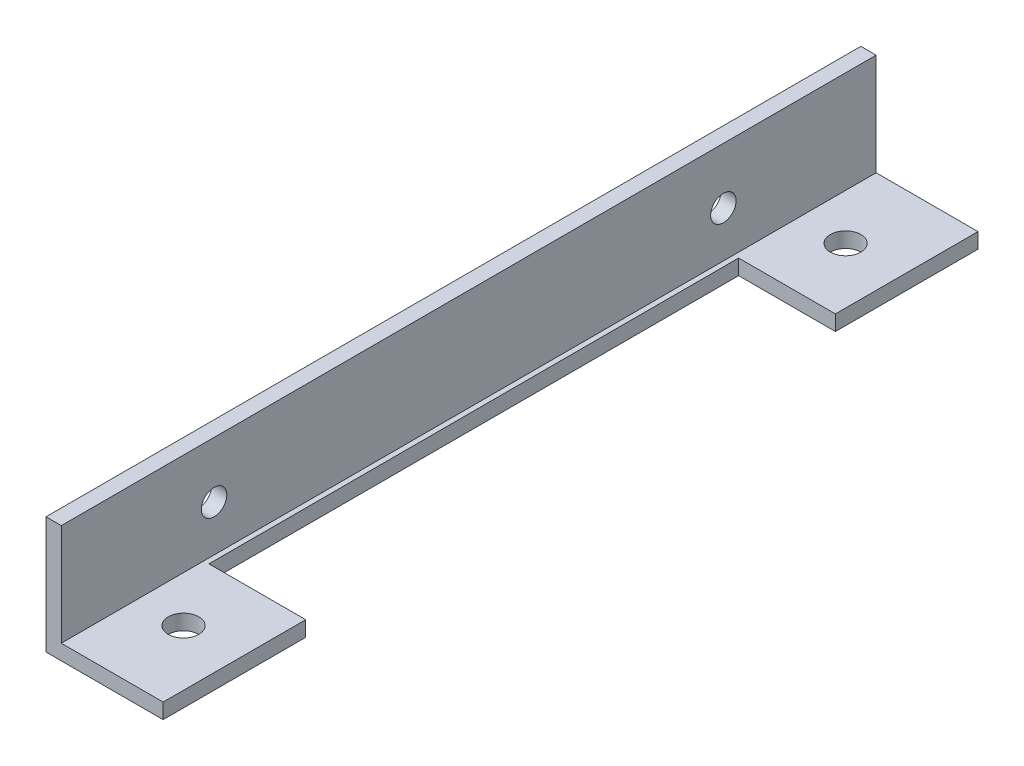
from build123d import *

# Parameters (mm, degrees)
EXTRU_MINCE1_DEPTH      = 80
ESQUISSE2_R             = 1.25
ENL_V_MAT_EXTRU_1_DEPTH = 10
ESQUISSE3_R             = 1.5
ESQUISSE3_W             = 9.5
ESQUISSE3_H             = 52
ENL_V_MAT_EXTRU_2_DEPTH = 10


with BuildPart() as part:
    # Esquisse1 → Extru.-Mince1 (new body)
    with BuildSketch(Plane.XY):
        Polygon((0, 11.5), (0, 0), (11.5, 0), (11.5, 1.5), (1.5, 1.5), (1.5, 11.5), align=None)
    extrude(amount=EXTRU_MINCE1_DEPTH)

    # Esquisse2 → Enlèv. mat.-Extru.1 (cut)
    with BuildSketch(Plane.ZY):
        with Locations(Location((15, 6, 0), (0, 0, 270))):
            Circle(ESQUISSE2_R)
        with Locations(Location((65, 6, 0), (0, 0, 90))):
            Circle(ESQUISSE2_R)
    extrude(amount=-ENL_V_MAT_EXTRU_1_DEPTH, mode=Mode.SUBTRACT)

    # Esquisse3 → Enlèv. mat.-Extru.2 (cut)
    with BuildSketch(Plane.XZ):
        with Locations(Location((6, 7.5, 0), (0, 0, 270))):
            Circle(ESQUISSE3_R)
        with Locations(Location((6, 72.5, 0), (0, 0, 90))):
            Circle(ESQUISSE3_R)
        with Locations((6.75, 40)):
            Rectangle(ESQUISSE3_W, ESQUISSE3_H)
    extrude(amount=-ENL_V_MAT_EXTRU_2_DEPTH, mode=Mode.SUBTRACT)


solid = part.part
